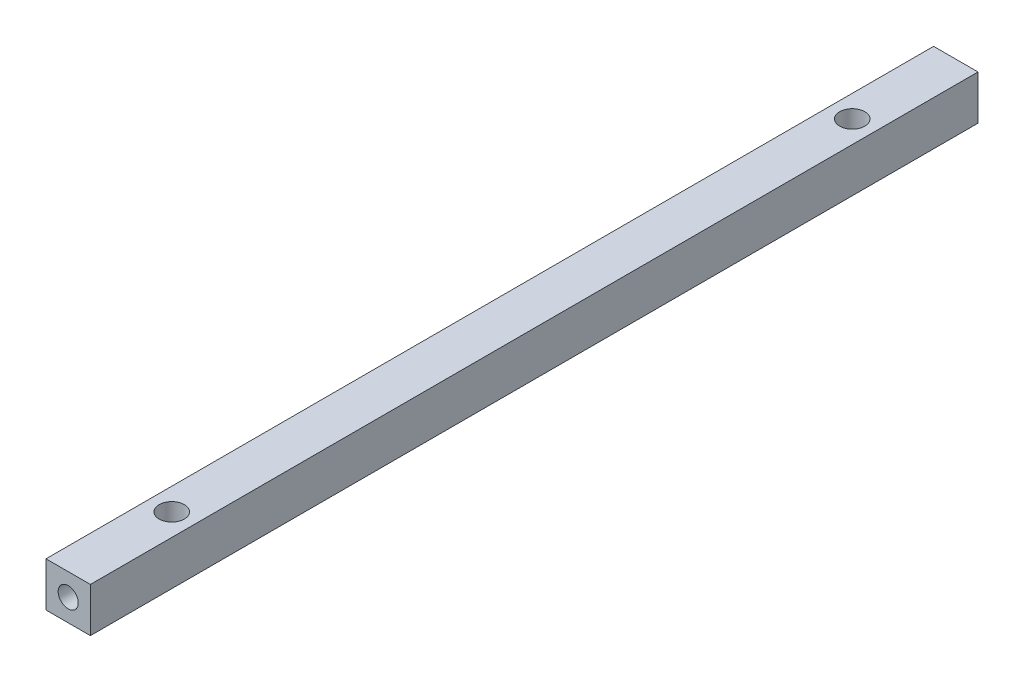
from build123d import *

# Parameters (mm, degrees)
IZIM1_W                     = 15
IZIM1_H                     = 15
Y_KSEKLIK_EKSTR_ZYON1_DEPTH = 150
DELIK1_D                    = 8.5
DELIK1_CBORE_D              = 14
DELIK1_CBORE_DEPTH          = 8


with BuildPart() as part:
    # Çizim1 → Yükseklik-Ekstrüzyon1 (new, symmetric)
    with BuildSketch(Plane.XY):
        Rectangle(IZIM1_W, IZIM1_H)
    extrude(amount=Y_KSEKLIK_EKSTR_ZYON1_DEPTH, both=True)

    # Çizim3 → M8 Dişli Delik1 (revolve, cut)
    with BuildSketch(Plane(origin=(0, 0, 150), x_dir=(0, -1, 0), z_dir=(1, 0, 0))):
        Polygon((0, 0), (0, 24.292926105), (3.4, 22.25), (3.4, 0), align=None)
    m8_di_li_delik1 = revolve(axis=Axis((0, 0, 156.35), (0, 0, -1)), mode=Mode.SUBTRACT)

    # Aynalama1: M8 Dişli Delik1 across plane
    add(m8_di_li_delik1.mirror(Plane.XY), mode=Mode.SUBTRACT)

    # Delik1 (through all)
    with Locations(Plane(origin=(0, -7.5, 0), x_dir=(-1, 0, 0), z_dir=(0, -1, 0))):
        with Locations((0, -115)):
            delik1 = CounterBoreHole(DELIK1_D / 2, DELIK1_CBORE_D / 2, DELIK1_CBORE_DEPTH)

    # Aynalama2: Delik1 across plane
    add(delik1.mirror(Plane.XY), mode=Mode.SUBTRACT)


solid = part.part
